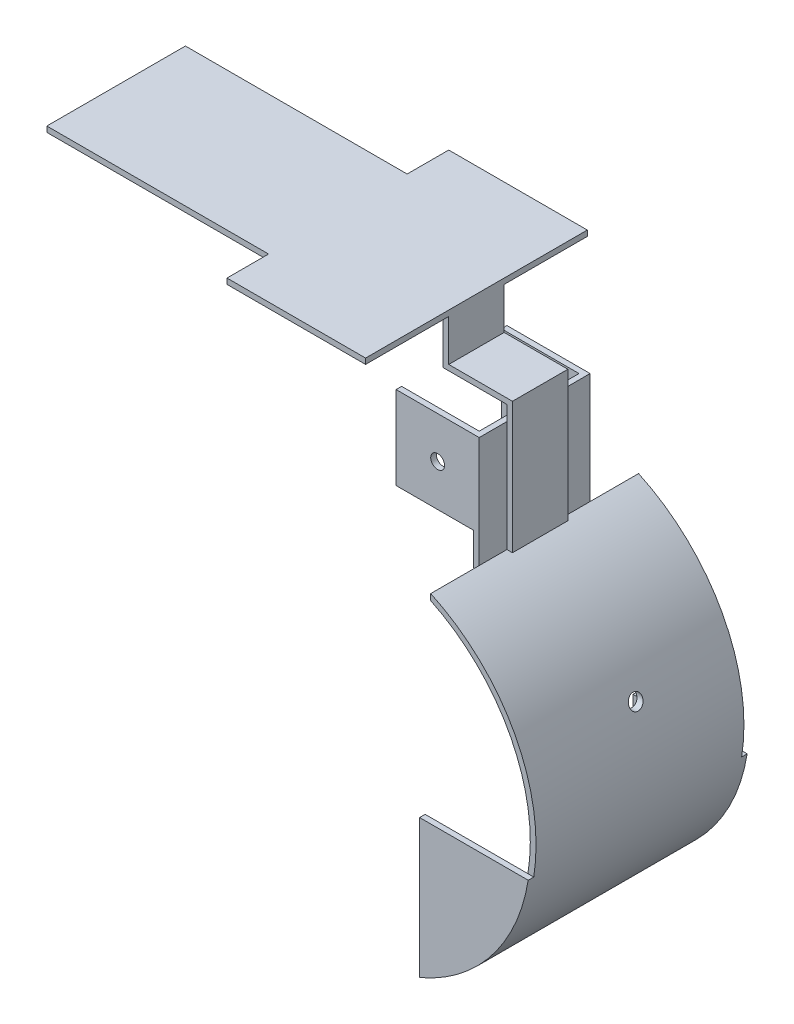
from build123d import *
from build123d.topology import SkipClean

# Parameters (mm, degrees)
SKETCH1_W           = 30
SKETCH1_H           = 30
SKETCH1_W_2         = 2
SKETCH1_H_2         = 10
BOSS_EXTRUDE1_DEPTH = 75
SKETCH2_W           = 30
SKETCH2_H           = 17.5
CUT_EXTRUDE1_DEPTH  = 75
SKETCH3_W           = 36
SKETCH3_H           = 30.162749864
CUT_EXTRUDE2_DEPTH  = 28
SKETCH5_R           = 2.5
CUT_EXTRUDE3_DEPTH  = 50
BOSS_EXTRUDE2_DEPTH = 2
BOSS_EXTRUDE3_START = 2
BOSS_EXTRUDE3_DEPTH = 2
SKETCH9_R           = 2.5
CUT_EXTRUDE4_DEPTH  = 169.967145294
SKETCH11_W          = 10
SKETCH11_H          = 40.338772632
SKETCH11_W_2        = 20
SKETCH11_H_2        = 5
BOSS_EXTRUDE4_DEPTH = 2
SKETCH13_W          = 25
SKETCH13_H          = 20
BOSS_EXTRUDE5_DEPTH = 2
SKETCH15_W          = 2
SKETCH15_H          = 20
BOSS_EXTRUDE6_DEPTH = 15
SKETCH16_W          = 80
SKETCH16_H          = 25
BOSS_EXTRUDE8_DEPTH = 2


with BuildPart() as part:
    # Sketch1 → Boss-Extrude1 (new body)
    with BuildSketch(Plane.XY):
        Rectangle(SKETCH1_W, SKETCH1_H)
        with BuildLine():
            Line((50.917737084, -85.641756384), (53, -85.641756384))
            ThreePointArc((53, -85.641756384), (42.989370072, -49.687860894), (15, -25))
            Line((15, -25), (14.157929479, -26.814088542))
            ThreePointArc((14.157929479, -26.814088542), (41.246515654, -50.786104008), (50.917737084, -85.641756384))
        make_face()
        with Locations((14, -20)):
            Rectangle(SKETCH1_W_2, SKETCH1_H_2)
        Polygon((14.157929479, -26.814088542), (15, -25), (13, -25), (13, -26.814088542), align=None)
        with BuildLine():
            Line((12.135037198, -143.180046466), (13, -144.983332176))
            ThreePointArc((13, -144.983332176), (41.796634815, -121.242036174), (53, -85.641756384))
            Line((53, -85.641756384), (50.917737084, -85.641756384))
            ThreePointArc((50.917737084, -85.641756384), (40.047121172, -120.154156399), (12.135037198, -143.180046466))
        make_face()
    extrude(amount=BOSS_EXTRUDE1_DEPTH)

    # Sketch2 → Cut-Extrude1 (cut)
    with BuildSketch(Plane(origin=(0, 15, 0), x_dir=(1, 0, 0), z_dir=(0, 1, 0))):
        with Locations((0, -8.75)):
            Rectangle(SKETCH2_W, SKETCH2_H)
        with Locations((0, -66.25)):
            Rectangle(SKETCH2_W, SKETCH2_H)
    extrude(amount=-CUT_EXTRUDE1_DEPTH, mode=Mode.SUBTRACT)

    # Sketch3 → Cut-Extrude2 (cut)
    with BuildSketch(Plane.ZY.offset(15)):
        with Locations((37.5, 0.030332794)):
            Rectangle(SKETCH3_W, SKETCH3_H)
    extrude(amount=-CUT_EXTRUDE2_DEPTH, mode=Mode.SUBTRACT)

    # Sketch5 → Cut-Extrude3 (cut)
    with BuildSketch(Plane.XY.offset(57.5)):
        Circle(SKETCH5_R)
    extrude(amount=-CUT_EXTRUDE3_DEPTH, mode=Mode.SUBTRACT)

    # Sketch6 → Boss-Extrude2 (add)
    with SkipClean():  # the faces are left unmerged after this step: merging them gives an invalid solid
        with BuildSketch(Plane.XY.offset(75)):
            with BuildLine():
                Line((13, -144.983332176), (13, -94.983332176))
                Line((13, -94.983332176), (52.174379027, -94.983332176))
                ThreePointArc((52.174379027, -94.983332176), (39.036739849, -125.036474764), (13, -144.983332176))
            make_face()
        extrude(amount=BOSS_EXTRUDE2_DEPTH)

    # Sketch7 → Boss-Extrude3 (add)
    with SkipClean():  # the faces are left unmerged after this step: merging them gives an invalid solid
        with BuildSketch(Plane(origin=(0, 0, 0), x_dir=(-1, 0, 0), z_dir=(0, 0, -1)).offset(BOSS_EXTRUDE3_START)):
            with BuildLine():
                Line((-13, -144.983332176), (-13, -94.983332176))
                Line((-13, -94.983332176), (-52.174379027, -94.983332176))
                ThreePointArc((-52.174379027, -94.983332176), (-39.036739849, -125.036474764), (-13, -144.983332176))
            make_face()
        extrude(amount=-BOSS_EXTRUDE3_DEPTH)

    # Sketch9 → Cut-Extrude4 (cut, through all)
    with SkipClean():  # the faces are left unmerged after this step: merging them gives an invalid solid
        with BuildSketch(Plane.ZY.offset(-13)):
            with Locations((35, -61.814088542)):
                Circle(SKETCH9_R)
        extrude(amount=-CUT_EXTRUDE4_DEPTH, mode=Mode.SUBTRACT)

    # Sketch11 → Boss-Extrude4 (add)
    with SkipClean():  # the faces are left unmerged after this step: merging them gives an invalid solid
        with BuildSketch(Plane(origin=(15, 0, 0), x_dir=(0, 0, -1), z_dir=(1, 0, 0))):
            with Locations((-42.5, -4.830613684)):
                Rectangle(SKETCH11_W, SKETCH11_H)
            with Locations((-32.5, -4.830613684)):
                Rectangle(SKETCH11_W, SKETCH11_H)
            with Locations((-37.5, 17.838772632)):
                Rectangle(SKETCH11_W_2, SKETCH11_H_2)
        extrude(amount=BOSS_EXTRUDE4_DEPTH)

    # Sketch13 → Boss-Extrude5 (add)
    with SkipClean():  # the faces are left unmerged after this step: merging them gives an invalid solid
        with BuildSketch(Plane(origin=(0, 20.338772632, 0), x_dir=(1, 0, 0), z_dir=(0, 1, 0))):
            with Locations((4.5, -37.5)):
                Rectangle(SKETCH13_W, SKETCH13_H)
        extrude(amount=BOSS_EXTRUDE5_DEPTH)

    # Sketch15 → Boss-Extrude6 (add)
    with SkipClean():  # the faces are left unmerged after this step: merging them gives an invalid solid
        with BuildSketch(Plane(origin=(0, 22.338772632, 0), x_dir=(1, 0, 0), z_dir=(0, 1, 0))):
            with Locations((-7, -37.5)):
                Rectangle(SKETCH15_W, SKETCH15_H)
        extrude(amount=BOSS_EXTRUDE6_DEPTH)

    # Sketch16 → Boss-Extrude8 (add)
    with SkipClean():  # the faces are left unmerged after this step: merging them gives an invalid solid
        with BuildSketch(Plane(origin=(0, 37.338772632, 0), x_dir=(1, 0, 0), z_dir=(0, 1, 0))):
            with Locations((-96, -50)):
                Rectangle(SKETCH16_W, SKETCH16_H)
            with Locations((-96, -25)):
                Rectangle(SKETCH16_W, SKETCH16_H)
            Polygon((-6, -77.5), (-6, -37.5), (-56, -37.5), (-56, -62.5), (-56, -77.5), align=None)
            Polygon((-56, -37.5), (-6, -37.5), (-6, 2.5), (-56, 2.5), (-56, -12.5), align=None)
        extrude(amount=BOSS_EXTRUDE8_DEPTH)


solid = part.part
